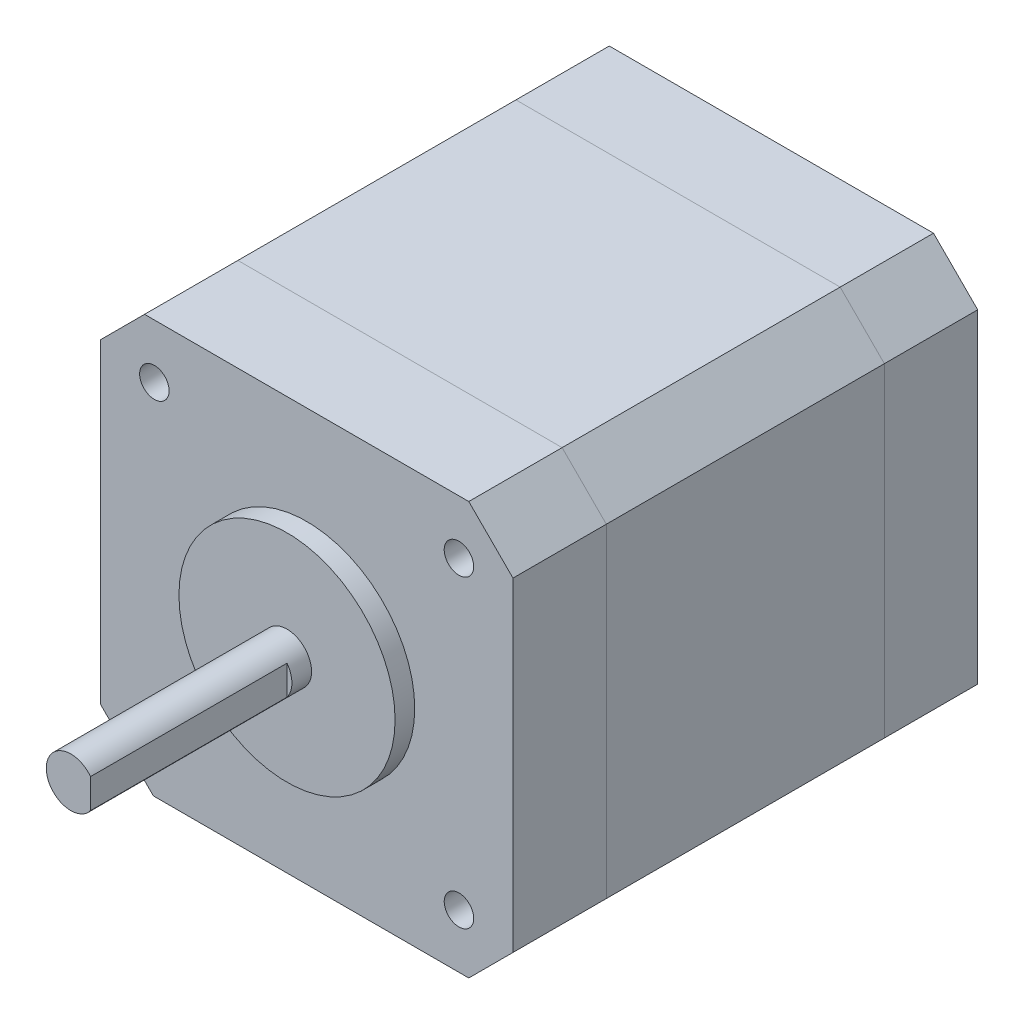
from build123d import *

# Parameters (mm, degrees)
BOSS_EXTRUDE1_DEPTH  = 9.5
BOSS_EXTRUDE7_DEPTH  = 9.5
EXTRUDE_5_DEPTH      = 28.3
SKETCH11_R           = 11
BOSS_EXTRUDE9_DEPTH  = 2
SKETCH10_R           = 1.5
CUT_EXTRUDE3_DEPTH   = 5.5
SKETCH12_R           = 2.5
BOSS_EXTRUDE10_DEPTH = 22
SKETCH14_R           = 1.5
CUT_EXTRUDE5_DEPTH   = 5.5
SKETCH16_R           = 4
CUT_EXTRUDE6_DEPTH   = 2
SKETCH17_R           = 2.5
BOSS_EXTRUDE11_DEPTH = 1
SKETCH18_R           = 2.75
CUT_EXTRUDE7_DEPTH   = 1
SKETCH_3_W           = 22
SKETCH_3_H           = 7.5
EXTRUDE_4_DEPTH      = 3
CUT_EXTRUDE_1_DEPTH  = 20


with BuildPart() as part:
    # Sketch1 → Boss-Extrude1 (new body)
    with BuildSketch(Plane.XY):
        Polygon((-21, 16.5), (-16.5, 21), (16.5, 21), (21, 16.5), (21, -16.5), (16.5, -21), (-15.6, -21), (-21, -15.6), align=None)
    extrude(amount=BOSS_EXTRUDE1_DEPTH)

    # Sketch14 → Cut-Extrude5 (cut)
    with BuildSketch(Plane(origin=(0, 0, 0), x_dir=(-1, 0, 0), z_dir=(0, 0, -1))):
        with Locations(Location((15.5, -15.5, 0), (0, 0, 180))):
            Circle(SKETCH14_R)
        with Locations(Location((-15.5, -15.5, 0), (0, 0, 180))):
            Circle(SKETCH14_R)
        with Locations(Location((-15.5, 15.5, 0), (0, 0, 180))):
            Circle(SKETCH14_R)
        with Locations(Location((15.5, 15.5, 0), (0, 0, 180))):
            Circle(SKETCH14_R)
    extrude(amount=-CUT_EXTRUDE5_DEPTH, mode=Mode.SUBTRACT)

    # Sketch16 → Cut-Extrude6 (cut)
    with BuildSketch(Plane(origin=(0, 0, 0), x_dir=(-1, 0, 0), z_dir=(0, 0, -1))):
        Circle(SKETCH16_R)
    extrude(amount=-CUT_EXTRUDE6_DEPTH, mode=Mode.SUBTRACT)

    # Sketch18 → Cut-Extrude7 (cut)
    with BuildSketch(Plane(origin=(0, 0, 0), x_dir=(-1, 0, 0), z_dir=(0, 0, -1))):
        with Locations((15.5, -15.5)):
            Circle(SKETCH18_R)
        with Locations((-15.5, -15.5)):
            Circle(SKETCH18_R)
        with Locations((-15.5, 15.5)):
            Circle(SKETCH18_R)
        with Locations((15.5, 15.5)):
            Circle(SKETCH18_R)
    extrude(amount=-CUT_EXTRUDE7_DEPTH, mode=Mode.SUBTRACT)


with BuildPart() as body_2:
    # Sketch8 → Boss-Extrude7 (new body)
    with BuildSketch(Plane(origin=(0, 0, 47.3), x_dir=(-1, 0, 0), z_dir=(0, 0, -1))):
        Polygon((21, 16.5), (16.5, 21), (-16.5, 21), (-21, 16.5), (-21, -16.5), (-16.5, -21), (15.6, -21), (21, -15.6), align=None)
    extrude(amount=BOSS_EXTRUDE7_DEPTH)

    # Sketch10 → Cut-Extrude3 (cut)
    with BuildSketch(Plane.XY.offset(47.3)):
        with Locations((-15.5, 15.5)):
            Circle(SKETCH10_R)
        with Locations((15.5, 15.5)):
            Circle(SKETCH10_R)
        with Locations((15.5, -15.5)):
            Circle(SKETCH10_R)
        with Locations((-15.5, -15.5)):
            Circle(SKETCH10_R)
    extrude(amount=-CUT_EXTRUDE3_DEPTH, mode=Mode.SUBTRACT)


with BuildPart() as body_3:
    # 草图6 → 凸台-拉伸5 (new body)
    with BuildSketch(Plane.XY.offset(9.5)):
        Polygon((16.5, 21), (-16.5, 21), (-21, 16.5), (-21, -15.6), (-15.6, -21), (16.5, -21), (21, -16.5), (21, 16.5), align=None)
    extrude(amount=EXTRUDE_5_DEPTH)


with BuildPart() as body_4:
    # Sketch11 → Boss-Extrude9 (new body)
    with BuildSketch(Plane.XY.offset(47.3)):
        Circle(SKETCH11_R)
    extrude(amount=BOSS_EXTRUDE9_DEPTH)


with BuildPart() as body_5:
    # Sketch12 → Boss-Extrude10 (new body)
    with BuildSketch(Plane.XY.offset(49.3)):
        Circle(SKETCH12_R)
    extrude(amount=BOSS_EXTRUDE10_DEPTH)

    # 草图5 → 切除-拉伸1 (cut)
    with BuildSketch(Plane.XY.offset(71.3)):
        with BuildLine():
            Line((2, 1.5), (2, -1.5))
            ThreePointArc((2, -1.5), (2.5, 0), (2, 1.5))
        make_face()
    extrude(amount=-CUT_EXTRUDE_1_DEPTH, mode=Mode.SUBTRACT)


with BuildPart() as body_6:
    # Sketch17 → Boss-Extrude11 (new body)
    with BuildSketch(Plane(origin=(0, 0, 2), x_dir=(-1, 0, 0), z_dir=(0, 0, -1))):
        Circle(SKETCH17_R)
    extrude(amount=BOSS_EXTRUDE11_DEPTH)


with BuildPart() as body_7:
    # 草图3 → 凸台-拉伸4 (new body)
    with BuildSketch(Plane(origin=(0, -21, 0), x_dir=(-1, 0, 0), z_dir=(0, -1, 0))):
        with Locations((0, -3.75)):
            Rectangle(SKETCH_3_W, SKETCH_3_H)
    extrude(amount=EXTRUDE_4_DEPTH)


solid = Compound([part.part, body_2.part, body_3.part, body_4.part, body_5.part, body_6.part, body_7.part])
